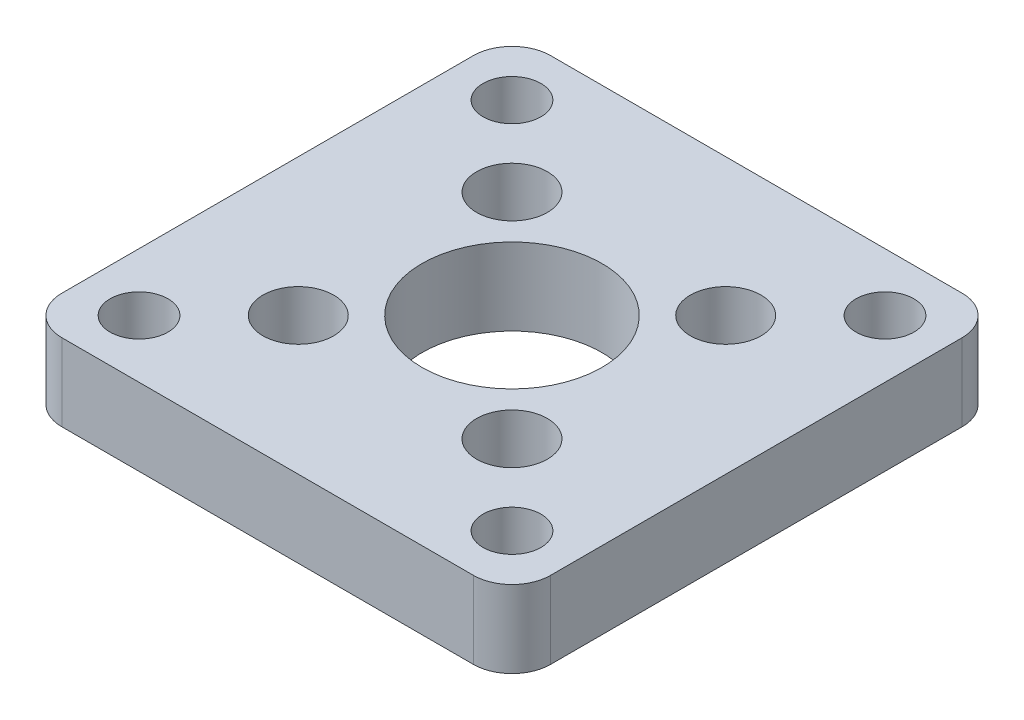
from build123d import *

# Parameters (mm, degrees)
SKETCH_1_W          = 38
SKETCH_1_H          = 38
EXTRUDE_1_DEPTH     = 3
SKETCH_2_R          = 2.25
CUT_EXTRUDE_1_DEPTH = 28.531799796
SKETCH_3_R          = 2.75
SKETCH_3_R_2        = 7
CUT_EXTRUDE_2_DEPTH = 28.531799796
FILLET_1_R          = 3


with BuildPart() as part:
    # 草图1 → 凸台-拉伸1 (new, symmetric)
    with BuildSketch(Plane(origin=(0, 0, 0), x_dir=(1, 0, 0), z_dir=(0, 1, 0))):
        Rectangle(SKETCH_1_W, SKETCH_1_H)
    extrude(amount=EXTRUDE_1_DEPTH, both=True)

    # 草图2 → 切除-拉伸1 (cut, through all)
    with BuildSketch(Plane(origin=(0, 3, 0), x_dir=(1, 0, 0), z_dir=(0, 1, 0))):
        with Locations(Location((-14.5, 14.5, 0), (0, 0, 270))):
            Circle(SKETCH_2_R)
        with Locations(Location((-14.5, -14.5, 0), (0, 0, 90))):
            Circle(SKETCH_2_R)
        with Locations(Location((14.5, -14.5, 0), (0, 0, 270))):
            Circle(SKETCH_2_R)
        with Locations(Location((14.5, 14.5, 0), (0, 0, 90))):
            Circle(SKETCH_2_R)
    extrude(amount=-CUT_EXTRUDE_1_DEPTH, mode=Mode.SUBTRACT)

    # 草图3 → 切除-拉伸2 (cut, through all)
    with BuildSketch(Plane(origin=(0, 3, 0), x_dir=(1, 0, 0), z_dir=(0, 1, 0))):
        with Locations(Location((-8.308504679, 8.308504679, 0), (0, 0, 270))):
            Circle(SKETCH_3_R)
        with Locations(Location((-8.308504679, -8.308504679, 0), (0, 0, 90))):
            Circle(SKETCH_3_R)
        with Locations(Location((8.308504679, -8.308504679, 0), (0, 0, 270))):
            Circle(SKETCH_3_R)
        with Locations(Location((8.308504679, 8.308504679, 0), (0, 0, 90))):
            Circle(SKETCH_3_R)
        with Locations(Location((0, 0, 0), (0, 0, 270))):
            Circle(SKETCH_3_R_2)
    extrude(amount=-CUT_EXTRUDE_2_DEPTH, mode=Mode.SUBTRACT)

    # 圆角1
    fillet_1_edges = [part.edges().sort_by_distance(p)[0] for p in [
        (-19, 0, -19),
        (19, 0, -19),
        (19, 0, 19),
        (-19, 0, 19),
    ]]
    fillet(fillet_1_edges, radius=FILLET_1_R)


solid = part.part
